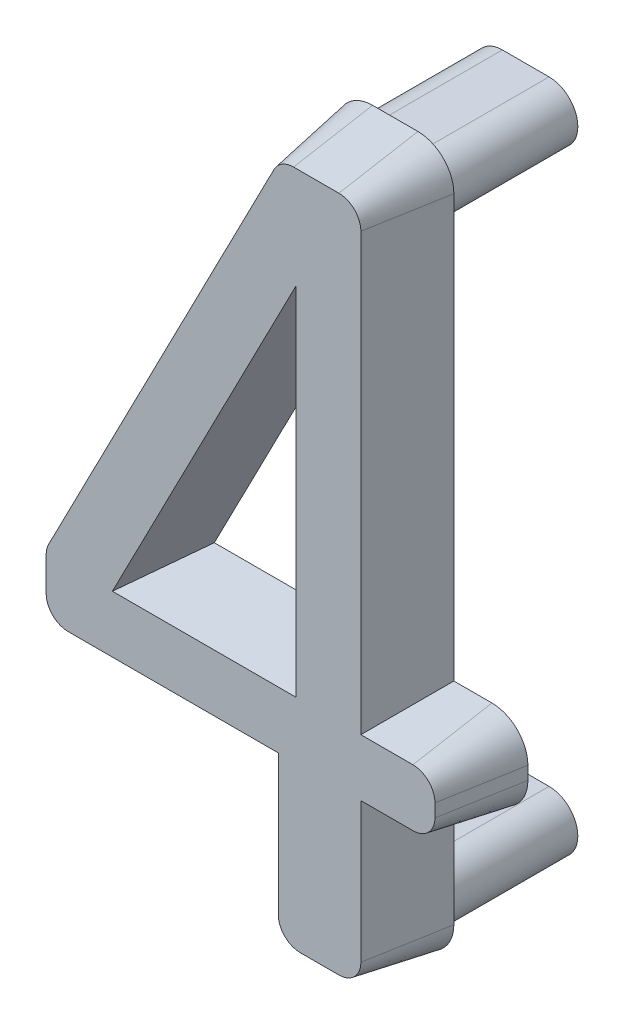
from build123d import *

# Parameters (mm, degrees)
BOSS_EXTRU_3_DEPTH = 2.2
BOSS_EXTRU_3_DRAFT = 10
BOSS_EXTRU_4_DEPTH = 3.6


with BuildPart() as part:
    # Esquisse2 → Boss.-Extru.3 (with draft: the straight prism first)
    with BuildSketch(Plane.XY):
        with BuildLine():
            ThreePointArc((59.333408072, 1.170179372), (59.626301291, 0.463072591), (60.333408072, 0.170179372))
            Line((60.333408072, 0.170179372), (61.407735426, 0.170179372))
            ThreePointArc((61.407735426, 0.170179372), (62.114842207, 0.463072591), (62.407735426, 1.170179372))
            Line((62.407735426, 1.170179372), (62.407735426, 4.679932735))
            Line((62.407735426, 4.679932735), (63.46838565, 4.679932735))
            ThreePointArc((63.46838565, 4.679932735), (64.175492431, 4.972825954), (64.46838565, 5.679932735))
            Line((64.46838565, 5.679932735), (64.46838565, 6.043946188))
            ThreePointArc((64.46838565, 6.043946188), (64.175492431, 6.75105297), (63.46838565, 7.043946188))
            Line((63.46838565, 7.043946188), (62.407735426, 7.043946188))
            Line((62.407735426, 7.043946188), (62.407735426, 18.788901345))
            ThreePointArc((62.407735426, 18.788901345), (62.114842207, 19.496008126), (61.407735426, 19.788901345))
            Line((61.407735426, 19.788901345), (60.146458975, 19.788901345))
            ThreePointArc((60.146458975, 19.788901345), (59.625963925, 19.642766032), (59.257594289, 19.24707115))
            Line((59.257594289, 19.24707115), (52.985126346, 7.078274373))
            ThreePointArc((52.985126346, 7.078274373), (52.902171942, 6.855832499), (52.873991031, 6.620104568))
            Line((52.873991031, 6.620104568), (52.873991031, 5.679932735))
            ThreePointArc((52.873991031, 5.679932735), (53.16688425, 4.972825954), (53.873991031, 4.679932735))
            Line((53.873991031, 4.679932735), (59.333408072, 4.679932735))
            Line((59.333408072, 4.679932735), (59.333408072, 2.689573991))
            Line((59.333408072, 2.689573991), (59.333408072, 1.170179372))
        make_face()
        Polygon((59.823459842, 7.043946188), (59.823459842, 14.963775897), (55.741143498, 7.043946188), align=None, mode=Mode.SUBTRACT)
    extrude(amount=BOSS_EXTRU_3_DEPTH)
    # Boss.-Extru.3: the draft: its side faces are tilted about the plane it starts from
    boss_extru_3_sides = [part.faces().sort_by_distance(p)[0] for p in [
        (60.777097201, 19.788901345, 1.1),
        (59.823459842, 11.003861043, 1.1),
        (57.78230167, 11.003861043, 1.1),
        (57.78230167, 7.043946188, 1.1),
        (62.407735426, 12.916423767, 1.1),
        (62.938060538, 7.043946188, 1.1),
        (64.175492431, 6.75105297, 1.1),
        (64.46838565, 5.861939462, 1.1),
        (64.175492431, 4.972825954, 1.1),
        (62.938060538, 4.679932735, 1.1),
        (62.407735426, 2.925056054, 1.1),
        (62.114842207, 0.463072591, 1.1),
        (60.870571749, 0.170179372, 1.1),
        (59.626301291, 0.463072591, 1.1),
        (59.333408072, 2.925056054, 1.1),
        (56.603699552, 4.679932735, 1.1),
        (53.16688425, 4.972825954, 1.1),
        (52.873991031, 6.150018652, 1.1),
        (52.902171942, 6.855832499, 1.1),
        (56.121360317, 13.162672762, 1.1),
        (59.625963925, 19.642766032, 1.1),
        (62.114842207, 19.496008126, 1.1),
    ]]
    draft(boss_extru_3_sides, Plane.XY, BOSS_EXTRU_3_DRAFT)

    # Esquisse3 → Boss.-Extru.4 (add)
    with BuildSketch(Plane.XY):
        with BuildLine():
            Line((60.157735426, 19.329540359), (61.457735426, 19.329540359))
            ThreePointArc((61.457735426, 19.329540359), (62.257735426, 18.529540359), (61.457735426, 17.729540359))
            Line((61.457735426, 17.729540359), (60.157735426, 17.729540359))
            ThreePointArc((60.157735426, 17.729540359), (59.357735426, 18.529540359), (60.157735426, 19.329540359))
        make_face()
        with BuildLine():
            Line((60.157735426, 2.229540359), (61.457735426, 2.229540359))
            ThreePointArc((61.457735426, 2.229540359), (62.257735426, 1.429540359), (61.457735426, 0.629540359))
            Line((61.457735426, 0.629540359), (60.157735426, 0.629540359))
            ThreePointArc((60.157735426, 0.629540359), (59.357735426, 1.429540359), (60.157735426, 2.229540359))
        make_face()
    extrude(amount=-BOSS_EXTRU_4_DEPTH)


solid = part.part
